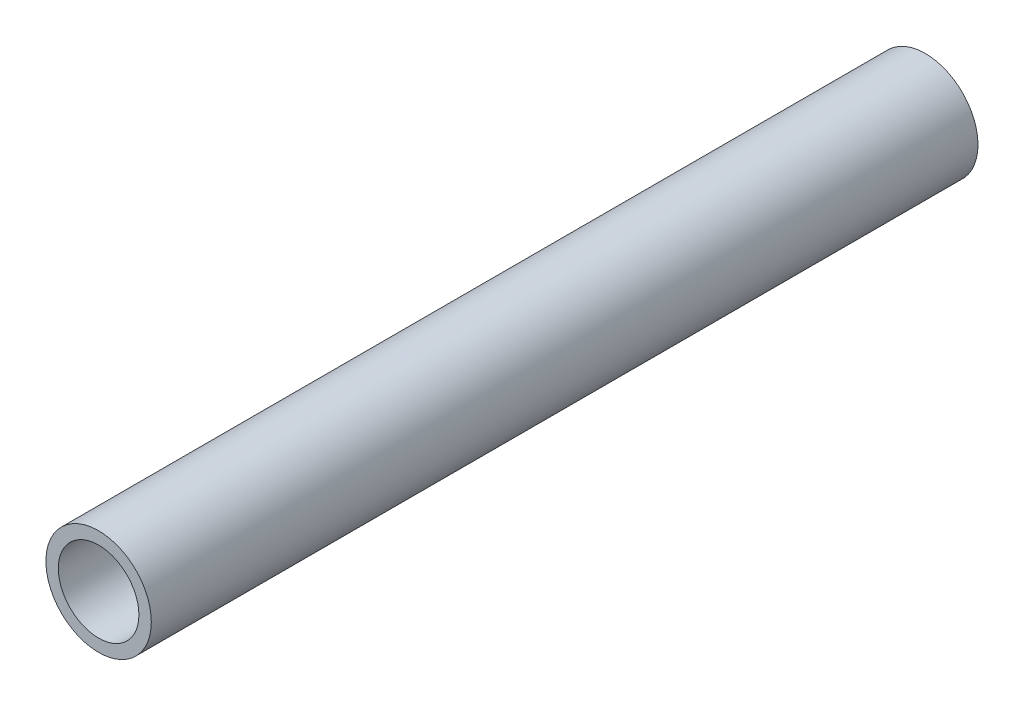
from build123d import *

# Parameters (mm, degrees)
SKETCH1_R           = 0.6477
SKETCH1_R_2         = 0.4953
BOSS_EXTRUDE1_DEPTH = 10.16


with BuildPart() as part:
    # Sketch1 → Boss-Extrude1 (new body)
    with BuildSketch(Plane.XY):
        Circle(SKETCH1_R)
        Circle(SKETCH1_R_2, mode=Mode.SUBTRACT)
    extrude(amount=BOSS_EXTRUDE1_DEPTH)


solid = part.part
